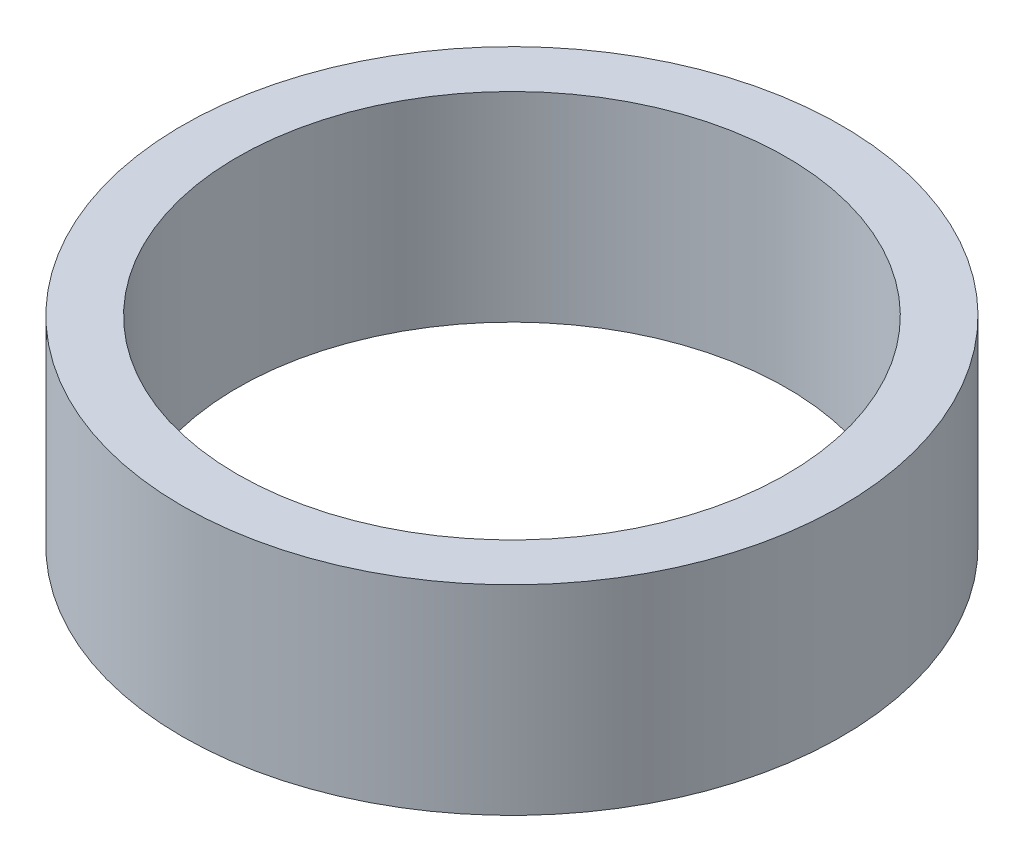
from build123d import *

# Parameters (mm, degrees)
SKETCH_1_R      = 16.5
SKETCH_1_R_2    = 13.75
EXTRUDE_1_DEPTH = 10


with BuildPart() as part:
    # 草图1 → 凸台-拉伸1 (new body)
    with BuildSketch(Plane(origin=(0, 0, 0), x_dir=(1, 0, 0), z_dir=(0, 1, 0))):
        with Locations(Location((0, 0, 0), (0, 0, 270))):
            Circle(SKETCH_1_R)
        with Locations(Location((0, 0, 0), (0, 0, 270))):
            Circle(SKETCH_1_R_2, mode=Mode.SUBTRACT)
    extrude(amount=EXTRUDE_1_DEPTH)


solid = part.part
